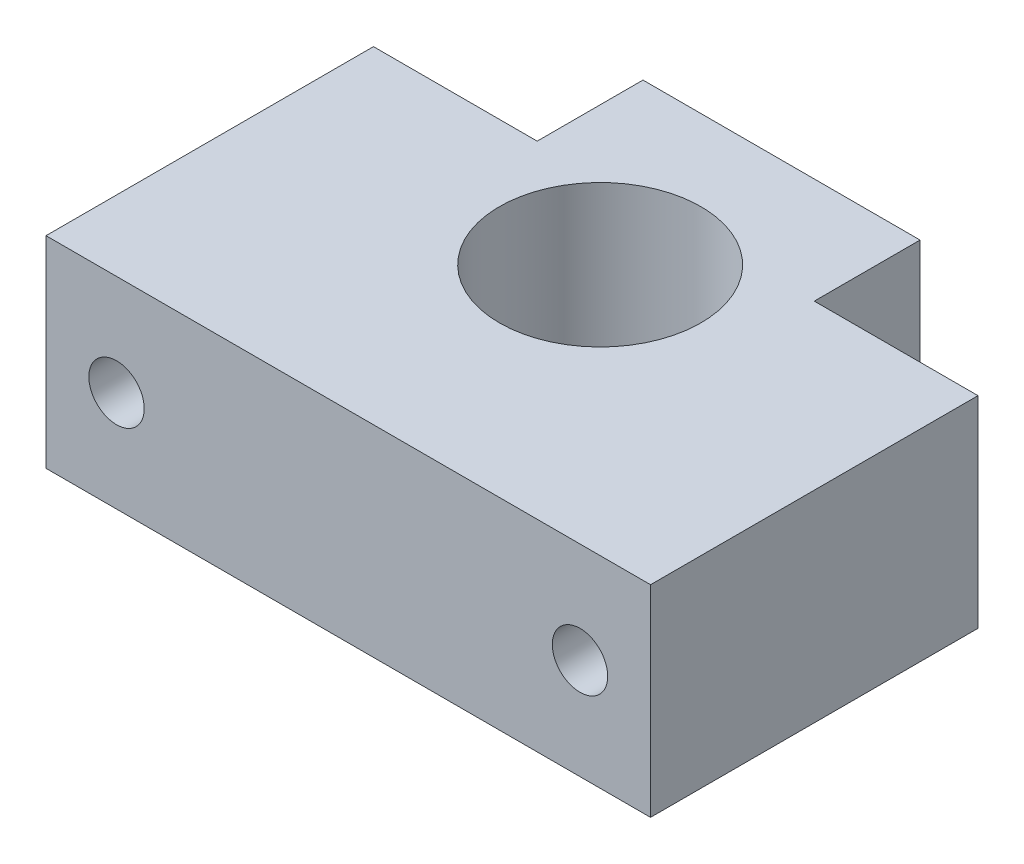
from build123d import *

# Parameters (mm, degrees)
BOSS_EXTRUDE1_DEPTH = 20
SKETCH2_R           = 10
CUT_EXTRUDE1_DEPTH  = 77.47875522
SKETCH6_R           = 2.75
CUT_EXTRUDE2_DEPTH  = 10


with BuildPart() as part:
    # Sketch1 → Boss-Extrude1 (new body)
    with BuildSketch(Plane(origin=(0, 0, 0), x_dir=(1, 0, 0), z_dir=(0, 1, 0))):
        Polygon((0, 32.5), (0, 0), (60, 0), (60, 32.5), (43.75, 32.5), (43.75, 43), (16.25, 43), (16.25, 32.5), align=None)
    extrude(amount=BOSS_EXTRUDE1_DEPTH)

    # Sketch2 → Cut-Extrude1 (cut, through all)
    with BuildSketch(Plane(origin=(0, 20, 0), x_dir=(1, 0, 0), z_dir=(0, 1, 0))):
        with Locations(Location((30, 25, 0), (0, 0, 270))):
            Circle(SKETCH2_R)
    extrude(amount=-CUT_EXTRUDE1_DEPTH, mode=Mode.SUBTRACT)

    # Sketch6 → Cut-Extrude2 (cut)
    with BuildSketch(Plane.XY):
        with Locations((7, 10)):
            Circle(SKETCH6_R)
        with Locations((53, 10)):
            Circle(SKETCH6_R)
    extrude(amount=-CUT_EXTRUDE2_DEPTH, mode=Mode.SUBTRACT)


solid = part.part
